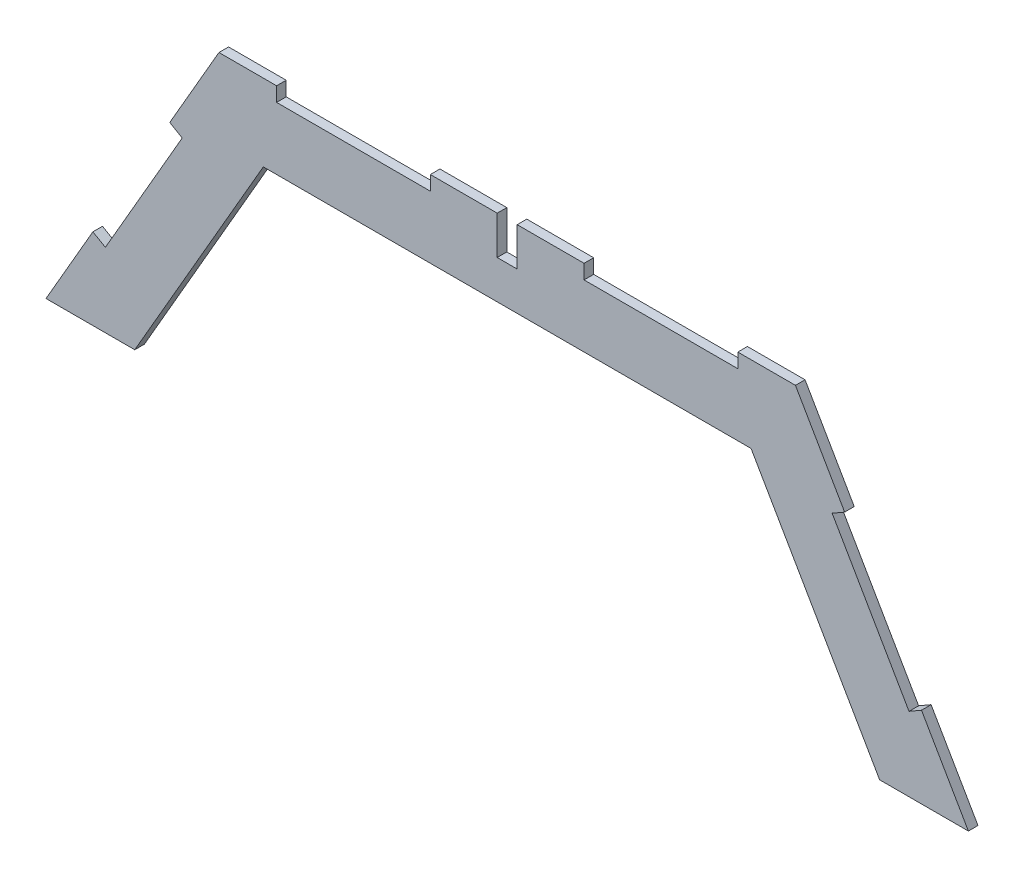
from build123d import *

# Parameters (mm, degrees)
BOSS_EXTRUDE1_DEPTH = 3.175
SKETCH2_W           = 6.604
SKETCH2_H           = 12.7
SKETCH2_W_2         = 50.8
SKETCH2_H_2         = 4.7625
CUT_EXTRUDE1_DEPTH  = 192.297317003


with BuildPart() as part:
    # Sketch1 → Boss-Extrude1 (new body)
    with BuildSketch(Plane.XY):
        Polygon((95.25, 0), (-95.25, 0), (-153.67, -101.186408178), (-131.672954744, -113.886408178), (-80.585303163, -25.4), (80.585303163, -25.4), (131.672954744, -113.886408178), (153.67, -101.186408178), align=None)
    extrude(amount=BOSS_EXTRUDE1_DEPTH)

    # Sketch2 → Cut-Extrude1 (cut, through all)
    with BuildSketch(Plane.XY.offset(3.175)):
        with Locations((0, -6.35)):
            Rectangle(SKETCH2_W, SKETCH2_H)
        Polygon((-111.506, -28.156217928), (-136.906, -72.15030844), (-132.781554014, -74.53155844), (-107.381554014, -30.537467928), align=None)
        with Locations((-50.8, -2.38125)):
            Rectangle(SKETCH2_W_2, SKETCH2_H_2)
        with Locations((50.8, -2.38125)):
            Rectangle(SKETCH2_W_2, SKETCH2_H_2)
        Polygon((107.381554014, -30.537467928), (111.506, -28.156217928), (136.906, -72.15030844), (132.781554014, -74.53155844), align=None)
        Polygon((-152.4, -98.986703653), (-123.070606325, -98.986703653), (-131.672954744, -113.886408178), (-153.67, -101.186408178), align=None)
        Polygon((153.67, -101.186408178), (152.4, -98.986703653), (123.070606325, -98.986703653), (131.672954744, -113.886408178), align=None)
    extrude(amount=-CUT_EXTRUDE1_DEPTH, mode=Mode.SUBTRACT)


solid = part.part
